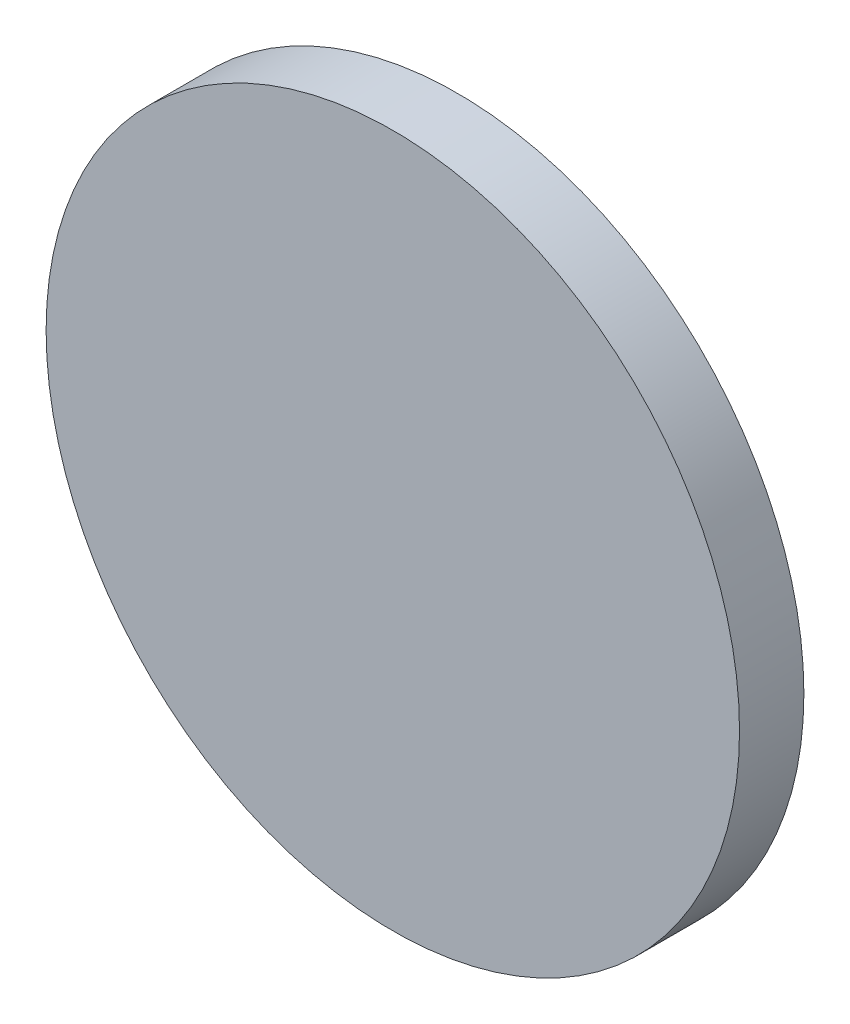
from build123d import *

# Parameters (mm, degrees)
SKETCH1_R      = 13.682300667
EXTRUDE1_DEPTH = 2.54


with BuildPart() as part:
    # Sketch1 → Extrude1 (new body)
    with BuildSketch(Plane.XY):
        Circle(SKETCH1_R)
    extrude(amount=EXTRUDE1_DEPTH)


solid = part.part
